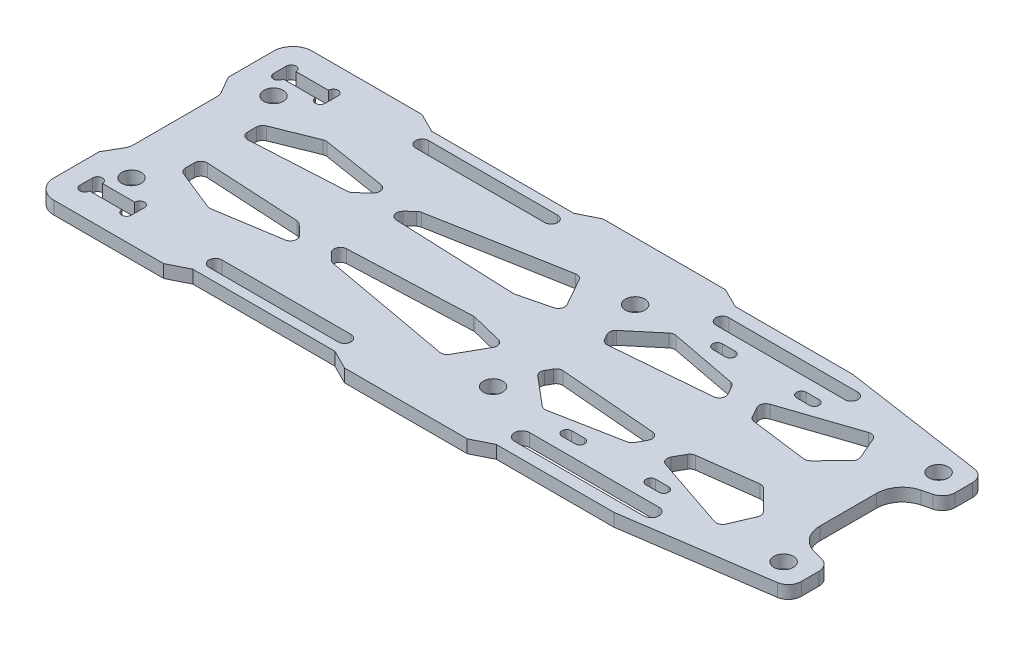
from build123d import *

# Parameters (mm, degrees)
SKETCH1_R           = 1.5
BOSS_EXTRUDE1_DEPTH = 2
FILLET1_R           = 3
FILLET2_R           = 2
FILLET3_R           = 2
FILLET4_R           = 4
CUT_EXTRUDE1_DEPTH  = 69.385685899
CUT_EXTRUDE2_DEPTH  = 69.385685899
FILLET5_R           = 1


with BuildPart() as part:
    # Sketch1 → Boss-Extrude1 (new body)
    with BuildSketch(Plane(origin=(0, 0, 0), x_dir=(1, 0, 0), z_dir=(0, 1, 0))):
        Polygon((31.36514389, 20), (-46.63485611, 20), (-46.63485611, 9.992729247), (-44.909046149, 6.998022761), (-44.909046149, -7), (-46.63485611, -9.992734036), (-46.63485611, -20), (-39.705923921, -20), (-25.563788298, -20), (31.36514389, -20), (65.36514389, -15), (65.36514389, -9), (59.36514389, -7.5), (59.36514389, 7.5), (65.36514389, 9), (65.36514389, 15), align=None)
        with BuildLine():
            ThreePointArc((-37.13485611, -14), (-36.38485611, -13.25), (-35.63485611, -14))
            Line((-35.63485611, -14), (-35.63485611, -16))
            ThreePointArc((-35.63485611, -16), (-36.38485611, -16.75), (-37.13485611, -16))
            Line((-37.13485611, -16), (-42.13485611, -16))
            ThreePointArc((-42.13485611, -16), (-42.88485611, -16.75), (-43.63485611, -16))
            Line((-43.63485611, -16), (-43.63485611, -14))
            ThreePointArc((-43.63485611, -14), (-42.88485611, -13.25), (-42.13485611, -14))
            Line((-42.13485611, -14), (-37.13485611, -14))
        make_face(mode=Mode.SUBTRACT)
        with Locations(Location((-40.63485611, -11, 0), (0, 0, 270))):
            Circle(SKETCH1_R, mode=Mode.SUBTRACT)
        with Locations(Location((15.36514389, -11, 0), (0, 0, 270))):
            Circle(SKETCH1_R, mode=Mode.SUBTRACT)
        with Locations(Location((61.36514389, -12, 0), (0, 0, 270))):
            Circle(SKETCH1_R, mode=Mode.SUBTRACT)
        with Locations(Location((-40.63485611, 11, 0), (0, 0, 270))):
            Circle(SKETCH1_R, mode=Mode.SUBTRACT)
        with BuildLine():
            Line((-35.63485611, 16), (-35.63485611, 14))
            ThreePointArc((-35.63485611, 14), (-36.38485611, 13.25), (-37.13485611, 14))
            Line((-37.13485611, 14), (-42.13485611, 14))
            ThreePointArc((-42.13485611, 14), (-42.88485611, 13.25), (-43.63485611, 14))
            Line((-43.63485611, 14), (-43.63485611, 16))
            ThreePointArc((-43.63485611, 16), (-42.88485611, 16.75), (-42.13485611, 16))
            Line((-42.13485611, 16), (-37.13485611, 16))
            ThreePointArc((-37.13485611, 16), (-36.38485611, 16.75), (-35.63485611, 16))
        make_face(mode=Mode.SUBTRACT)
        with Locations(Location((15.36514389, 11, 0), (0, 0, 270))):
            Circle(SKETCH1_R, mode=Mode.SUBTRACT)
        with Locations(Location((61.36514389, 12, 0), (0, 0, 270))):
            Circle(SKETCH1_R, mode=Mode.SUBTRACT)
    extrude(amount=BOSS_EXTRUDE1_DEPTH)

    # Fillet1
    fillet1_edges = [part.edges().sort_by_distance(p)[0] for p in [
        (-46.63485611, 1, -20),
        (-46.63485611, 1, 20),
    ]]
    fillet(fillet1_edges, radius=FILLET1_R)

    # Fillet2
    fillet2_edges = [part.edges().sort_by_distance(p)[0] for p in [
        (65.36514389, 1, -15),
        (65.36514389, 1, -9),
        (65.36514389, 1, 9),
        (65.36514389, 1, 15),
    ]]
    fillet(fillet2_edges, radius=FILLET2_R)

    # Fillet3
    fillet3_edges = [part.edges().sort_by_distance(p)[0] for p in [
        (-44.909046149, 1, -6.998022761),
        (-44.909046149, 1, 7),
    ]]
    fillet(fillet3_edges, radius=FILLET3_R)

    # Fillet4
    fillet4_edges = [part.edges().sort_by_distance(p)[0] for p in [
        (59.36514389, 1, -7.5),
        (59.36514389, 1, 7.5),
    ]]
    fillet(fillet4_edges, radius=FILLET4_R)

    # Sketch3 → Cut-Extrude1 (cut, through all)
    with BuildSketch(Plane(origin=(0, 2, 0), x_dir=(1, 0, 0), z_dir=(0, 1, 0))):
        Polygon((-26.63485611, 20), (-23.63485611, 18.5), (-1.63485611, 18.5), (1.36514389, 20), align=None)
        Polygon((31.36514389, 20), (20.36514389, 20), (23.36514389, 18.5), (41.56514389, 18.5), align=None)
        Polygon((-23.63485611, -18.5), (-26.63485611, -20), (1.36514389, -20), (-1.63485611, -18.5), align=None)
        Polygon((23.36514389, -18.5), (20.36514389, -20), (31.36514389, -20), (41.56514389, -18.5), align=None)
        with BuildLine():
            Line((-2.63485611, 17), (-22.63485611, 17))
            ThreePointArc((-22.63485611, 17), (-23.63485611, 16), (-22.63485611, 15))
            Line((-22.63485611, 15), (-2.63485611, 15))
            ThreePointArc((-2.63485611, 15), (-1.63485611, 16), (-2.63485611, 17))
        make_face()
        with BuildLine():
            Line((-2.63485611, -15), (-22.63485611, -15))
            ThreePointArc((-22.63485611, -15), (-23.63485611, -16), (-22.63485611, -17))
            Line((-22.63485611, -17), (-2.63485611, -17))
            ThreePointArc((-2.63485611, -17), (-1.63485611, -16), (-2.63485611, -15))
        make_face()
        with BuildLine():
            Line((44.36514389, -14.326886921), (24.36514389, -14.326886921))
            ThreePointArc((24.36514389, -14.326886921), (23.192030811, -15.5), (24.36514389, -16.673113079))
            Line((24.36514389, -16.673113079), (44.36514389, -16.673113079))
            ThreePointArc((44.36514389, -16.673113079), (45.53825697, -15.5), (44.36514389, -14.326886921))
        make_face()
        with BuildLine():
            Line((44.36514389, 16.5), (24.36514389, 16.5))
            ThreePointArc((24.36514389, 16.5), (23.36514389, 15.5), (24.36514389, 14.5))
            Line((24.36514389, 14.5), (44.36514389, 14.5))
            ThreePointArc((44.36514389, 14.5), (45.36514389, 15.5), (44.36514389, 16.5))
        make_face()
    extrude(amount=-CUT_EXTRUDE1_DEPTH, mode=Mode.SUBTRACT)

    # Sketch6 → Cut-Extrude2 (cut, through all)
    with BuildSketch(Plane(origin=(0, 2, 0), x_dir=(1, 0, 0), z_dir=(0, 1, 0))):
        Polygon((-30.62851742, 9.044874772), (-37.78703243, 6.161584004), (-37.78703243, 3.055096907), (-21.716896694, 3.945952624), (-18.454172166, 7.112953806), align=None)
        Polygon((7.332636069, 10.647435432), (-13.864475479, 6.789561488), (-16.794033081, 3.945952624), (4.530991674, 3.055096907), (10.739916471, 4.589142128), align=None)
        Polygon((-16.793969809, -3.947173623), (4.531040661, -3.055976019), (10.739990051, -4.589921697), (7.332806778, -10.648269627), (-13.864366618, -6.790735519), align=None)
        Polygon((-37.786983437, -3.05665447), (-21.716833421, -3.947252548), (-18.45405812, -7.11420142), (-30.628372399, -9.046317568), (-37.786933634, -6.163141567), align=None)
        Polygon((35.319865926, 4.845095767), (17.998267472, 3.385855734), (16.762823754, 5.582528599), (22.176162161, 10.127059607), (33.57789769, 7.94239134), align=None)
        Polygon((35.319943607, -4.845481266), (17.99832176, -3.386518936), (16.76291326, -5.583211607), (22.176324525, -10.127655827), (33.578025028, -7.942804765), align=None)
        Polygon((37.999580432, -7.687502586), (39.736583, -4.598920298), (49.571185346, -3.314751775), (53.562393768, -7.343376978), (51.468999242, -12.232343608), align=None)
        Polygon((53.562276038, 7.343283946), (51.468803132, 12.232217014), (37.999457187, 7.687160048), (39.736509271, 4.598605609), (49.571132204, 3.314594755), align=None)
        with BuildLine():
            Line((40.36514389, 11), (42.36514389, 11))
            ThreePointArc((42.36514389, 11), (43.11514389, 11.75), (42.36514389, 12.5))
            Line((42.36514389, 12.5), (40.36514389, 12.5))
            ThreePointArc((40.36514389, 12.5), (39.61514389, 11.75), (40.36514389, 11))
        make_face()
        with BuildLine():
            Line((27.36514389, 11), (29.36514389, 11))
            ThreePointArc((29.36514389, 11), (30.11514389, 11.75), (29.36514389, 12.5))
            Line((29.36514389, 12.5), (27.36514389, 12.5))
            ThreePointArc((27.36514389, 12.5), (26.61514389, 11.75), (27.36514389, 11))
        make_face()
        with BuildLine():
            Line((27.36514389, -12.326886921), (29.36514389, -12.326886921))
            ThreePointArc((29.36514389, -12.326886921), (30.11514389, -11.576886921), (29.36514389, -10.826886921))
            Line((29.36514389, -10.826886921), (27.36514389, -10.826886921))
            ThreePointArc((27.36514389, -10.826886921), (26.61514389, -11.576886921), (27.36514389, -12.326886921))
        make_face()
        with BuildLine():
            Line((40.36514389, -12.326886921), (42.36514389, -12.326886921))
            ThreePointArc((42.36514389, -12.326886921), (43.11514389, -11.576886921), (42.36514389, -10.826886921))
            Line((42.36514389, -10.826886921), (40.36514389, -10.826886921))
            ThreePointArc((40.36514389, -10.826886921), (39.61514389, -11.576886921), (40.36514389, -12.326886921))
        make_face()
    extrude(amount=-CUT_EXTRUDE2_DEPTH, mode=Mode.SUBTRACT)

    # Fillet5
    fillet5_edges = [part.edges().sort_by_distance(p)[0] for p in [
        (-37.78703243, 1, -6.161584004),
        (-30.62851742, 1, -9.044874772),
        (-18.454172166, 1, -7.112953806),
        (-21.716896694, 1, -3.945952624),
        (-37.78703243, 1, -3.055096907),
        (37.999580432, 1, 7.687502586),
        (39.736583, 1, 4.598920298),
        (49.571185346, 1, 3.314751775),
        (53.562393768, 1, 7.343376978),
        (51.468999242, 1, 12.232343608),
        (51.468803132, 1, -12.232217014),
        (53.562276038, 1, -7.343283946),
        (49.571132204, 1, -3.314594755),
        (39.736509271, 1, -4.598605609),
        (37.999457187, 1, -7.687160048),
        (-13.864475479, 1, -6.789561488),
        (7.332636069, 1, -10.647435432),
        (10.739916471, 1, -4.589142128),
        (4.530991674, 1, -3.055096907),
        (-16.794033081, 1, -3.945952624),
        (-16.793969809, 1, 3.947173623),
        (4.531040661, 1, 3.055976019),
        (10.739990051, 1, 4.589921697),
        (7.332806778, 1, 10.648269627),
        (-13.864366618, 1, 6.790735519),
        (-37.786983437, 1, 3.05665447),
        (-21.716833421, 1, 3.947252548),
        (-18.45405812, 1, 7.11420142),
        (-30.628372399, 1, 9.046317568),
        (-37.786933634, 1, 6.163141567),
        (35.319865926, 1, -4.845095767),
        (17.998267472, 1, -3.385855734),
        (16.762823754, 1, -5.582528599),
        (22.176162161, 1, -10.127059607),
        (33.57789769, 1, -7.94239134),
        (17.99832176, 1, 3.386518936),
        (35.319943607, 1, 4.845481266),
        (33.578025028, 1, 7.942804765),
        (22.176324525, 1, 10.127655827),
        (16.76291326, 1, 5.583211607),
    ]]
    fillet(fillet5_edges, radius=FILLET5_R)


solid = part.part
